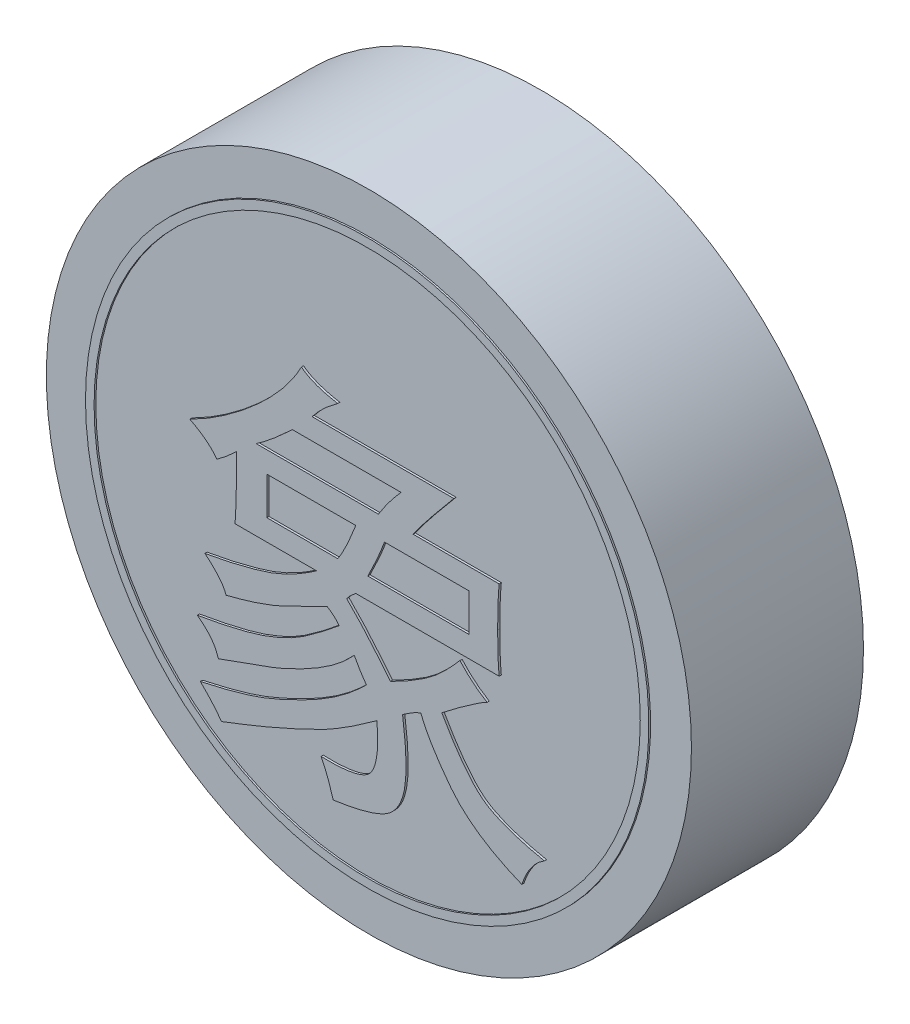
from build123d import *

# Parameters (mm, degrees)
SKETCH_1_R               = 15
DIAMETER30_HEIGHT8_DEPTH = 8
CHARACTER_DEPTH          = 0.1
SKETCH_3_R               = 13.1
SKETCH_3_R_2             = 12.7
INK_RING_DEPTH           = 0.08


with BuildPart() as part:
    # 草图1 → Diameter30_Height8 (new body)
    with BuildSketch(Plane.XY):
        Circle(SKETCH_1_R)
    extrude(amount=-DIAMETER30_HEIGHT8_DEPTH)

    # 草图2 → Character_象 (add)
    with BuildSketch(Plane.XY):
        with BuildLine():
            add(Edge.make_bspline(
                [(-0.929824561, -1.903508772), (-0.828743166, -2.004305693), (-0.635654735, -2.196850711), (-0.367903893, -2.481889137), (-0.12888562, -2.742919032), (0.088565858, -2.993303237), (0.304738016, -3.253167706), (0.548069364, -3.536422638), (0.813868216, -3.86678204), (1.004480711, -4.097376274), (1.105263158, -4.219298246)],
                knots=[0, 0, 0, 0, 1.110570339, 2.121441658, 3.042347323, 3.864152732, 4.701322879, 5.672279288, 6.769265416, 8, 8, 8, 8], degree=3))
            add(Edge.make_bspline(
                [(1.105263158, -4.219298246), (1.263308951, -4.137710103), (1.570224915, -3.979270558), (2.011035586, -3.736783677), (2.412727785, -3.487723983), (2.795695198, -3.24013725), (3.166100989, -2.953776542), (3.544692025, -2.615976785), (3.936594798, -2.212129154), (4.196832054, -1.917630288), (4.333333333, -1.763157895)],
                knots=[0, 0, 0, 0, 1.043545067, 2.026505312, 2.950571977, 3.816170627, 4.700665882, 5.694331323, 6.790616194, 8, 8, 8, 8], degree=3))
            add(Edge.make_bspline(
                [(4.333333333, -1.763157895), (4.42790443, -1.865267048), (4.616739779, -2.069154054), (4.926361469, -2.344080436), (5.249755107, -2.598635688), (5.480734886, -2.74329363), (5.596491228, -2.815789474)],
                knots=[0, 0, 0, 0, 1.011439186, 2.01959667, 3.007513797, 4, 4, 4, 4], degree=3))
            add(Edge.make_bspline(
                [(5.596491228, -2.815789474), (5.544137443, -2.842857439), (5.4268187, -2.903513602), (5.242508625, -3.019881513), (5.024551415, -3.159977335), (4.779416207, -3.333767264), (4.498420972, -3.529289787), (4.188699149, -3.755864532), (3.851873066, -4.015150294), (3.615212847, -4.195165085), (3.49122807, -4.289473684)],
                knots=[0, 0, 0, 0, 0.549629301, 1.231655349, 2.032014221, 2.967000527, 4.034417747, 5.225908916, 6.546671411, 8, 8, 8, 8], degree=3))
            add(Edge.make_bspline(
                [(3.49122807, -4.289473684), (3.588000347, -4.457355531), (3.774212015, -4.780398036), (4.06003518, -5.234255032), (4.334494295, -5.641493282), (4.602394398, -5.999061028), (4.862037369, -6.308651957), (5.11031353, -6.573598651), (5.351477806, -6.788776456), (5.592415125, -6.959432108), (5.842605156, -7.099520305), (6.111453286, -7.228983899), (6.405140072, -7.353950773), (6.725440224, -7.470417875), (7.072652245, -7.5793096), (7.445742268, -7.681866018), (7.844701467, -7.782440517), (8.120830615, -7.839176967), (8.263157895, -7.868421053)],
                knots=[0, 0, 0, 0, 1.486202843, 2.85978918, 4.113129665, 5.252135739, 6.285069278, 7.211058629, 8.034996073, 8.759608627, 9.470935696, 10.231786858, 11.047645233, 11.91800264, 12.844850006, 13.838006363, 14.885627704, 16, 16, 16, 16], degree=3))
            add(Edge.make_bspline(
                [(8.263157895, -7.868421053), (8.206020036, -7.905389145), (8.089977106, -7.980468712), (7.929184397, -8.116179271), (7.780767929, -8.272730064), (7.646055706, -8.449532578), (7.516088949, -8.641819632), (7.404305757, -8.858684382), (7.299214682, -9.09269016), (7.240570791, -9.257612265), (7.210526316, -9.342105263)],
                knots=[0, 0, 0, 0, 0.882392205, 1.792075865, 2.722432891, 3.675867886, 4.673605813, 5.729677539, 6.836866955, 8, 8, 8, 8], degree=3))
            add(Edge.make_bspline(
                [(7.210526316, -9.342105263), (7.028513508, -9.266211584), (6.674438587, -9.118573354), (6.171719859, -8.867864212), (5.703171782, -8.614170137), (5.275236792, -8.341866936), (4.884914504, -8.06055426), (4.534294439, -7.763895988), (4.218668392, -7.459859643), (3.945252749, -7.139348591), (3.705320935, -6.815912929), (3.476257516, -6.504250126), (3.270431153, -6.197689208), (3.077821516, -5.901770903), (2.910470835, -5.609301836), (2.75646074, -5.327986995), (2.622026019, -5.053373888), (2.545999688, -4.870331828), (2.50877193, -4.780701754)],
                knots=[0, 0, 0, 0, 1.402005598, 2.727363134, 3.993048918, 5.189525805, 6.331940506, 7.411907485, 8.453221336, 9.444943128, 10.403636806, 11.316844739, 12.19519781, 13.029237124, 13.827081363, 14.59072091, 15.309919328, 16, 16, 16, 16], degree=3))
            add(Edge.make_bspline(
                [(2.50877193, -4.780701754), (2.44678808, -4.807449537), (2.314995297, -4.864321846), (2.113751629, -4.976839779), (1.894790194, -5.113704486), (1.745067828, -5.217551171), (1.666666667, -5.271929825)],
                knots=[0, 0, 0, 0, 0.828774227, 1.762176171, 2.828177836, 4, 4, 4, 4], degree=3))
            add(Edge.make_bspline(
                [(1.666666667, -5.271929825), (1.6882625, -5.436439302), (1.729920898, -5.753778344), (1.777254782, -6.214838325), (1.807566, -6.643928413), (1.828680049, -7.041698776), (1.826748323, -7.408462587), (1.817192924, -7.743570187), (1.784349637, -8.046146182), (1.742677864, -8.319635781), (1.678971869, -8.566173326), (1.601486451, -8.792064676), (1.505775788, -8.998315058), (1.390228621, -9.184757599), (1.257750812, -9.351567846), (1.107551929, -9.498963433), (0.940669648, -9.627630527), (0.752176213, -9.734440338), (0.543791689, -9.827288689), (0.31396618, -9.915989893), (0.060674025, -9.998581098), (-0.217571459, -10.072731846), (-0.518450691, -10.147275117), (-0.845381499, -10.208925663), (-1.19469197, -10.274185765), (-1.436479122, -10.307400379), (-1.561403509, -10.324561404)],
                knots=[0, 0, 0, 0, 1.649230934, 3.181369092, 4.606057711, 5.92503094, 7.139285108, 8.251032652, 9.255324516, 10.162831072, 10.998302206, 11.782679226, 12.533926344, 13.253250842, 13.957993629, 14.64612434, 15.340264104, 16.046321073, 16.793956285, 17.606385427, 18.494187721, 19.440577461, 20.468228072, 21.574458556, 22.746793299, 24, 24, 24, 24], degree=3))
            add(Edge.make_bspline(
                [(-1.561403509, -10.324561404), (-1.598378631, -10.196852294), (-1.671857895, -9.943060799), (-1.802157951, -9.569418455), (-1.953258682, -9.205797776), (-2.066331616, -8.969098834), (-2.122807018, -8.850877193)],
                knots=[0, 0, 0, 0, 1.010024267, 2.007183108, 3.004667778, 4, 4, 4, 4], degree=3))
            add(Edge.make_bspline(
                [(-2.122807018, -8.850877193), (-1.966869659, -8.855238357), (-1.67224315, -8.863478298), (-1.253809565, -8.848384695), (-0.88538314, -8.811002274), (-0.565123639, -8.752196228), (-0.293372988, -8.674565414), (-0.06956973, -8.573160897), (0.10888208, -8.450043127), (0.233070526, -8.292060231), (0.321108577, -8.113205604), (0.39495621, -7.911275203), (0.446817096, -7.679562792), (0.485565396, -7.420739837), (0.508828255, -7.134195927), (0.512186341, -6.819186367), (0.5020602, -6.475770691), (0.483397854, -6.237864099), (0.473684211, -6.114035088)],
                knots=[0, 0, 0, 0, 1.58471914, 2.994152737, 4.251101141, 5.343957484, 6.29925099, 7.114494205, 7.832878125, 8.477647425, 9.131190312, 9.852427002, 10.657387502, 11.53880839, 12.510349002, 13.575629989, 14.738129365, 16, 16, 16, 16], degree=3))
            add(Edge.make_bspline(
                [(0.473684211, -6.114035088), (0.347187426, -6.204122011), (0.100672391, -6.379682056), (-0.259624694, -6.636613384), (-0.608445705, -6.869485719), (-0.941052133, -7.085381948), (-1.257126872, -7.283913504), (-1.560315475, -7.459639019), (-1.84439206, -7.62254617), (-2.378821322, -7.896324739), (-3.170280863, -8.27191044), (-4.056917556, -8.677340052), (-4.796894435, -8.988172781), (-5.40245326, -9.236084417), (-6.059649245, -9.497940279), (-6.517639841, -9.672779424), (-6.754385965, -9.763157895)],
                knots=[0, 0, 0, 0, 0.802634635, 1.564162327, 2.28693694, 2.970022653, 3.613619897, 4.215691619, 4.781081017, 5.305786877, 7.318484086, 9.308460638, 10.343841297, 11.466371935, 12.690307994, 14, 14, 14, 14], degree=3))
            add(Edge.make_bspline(
                [(-6.754385965, -9.763157895), (-6.808823097, -9.686144779), (-6.928980908, -9.516155528), (-7.151382439, -9.254577297), (-7.423646659, -8.95644167), (-7.627730051, -8.750471622), (-7.736842105, -8.640350877)],
                knots=[0, 0, 0, 0, 0.757198483, 1.671346525, 2.754998321, 4, 4, 4, 4], degree=3))
            add(Edge.make_bspline(
                [(-7.736842105, -8.640350877), (-7.519124707, -8.592957982), (-7.09382113, -8.500377564), (-6.473677177, -8.34554628), (-5.883610448, -8.186126947), (-5.408946683, -8.040118666), (-5.032118, -7.914743296), (-4.738483602, -7.804962586), (-4.430340787, -7.68013717), (-4.108065065, -7.542200968), (-3.771569852, -7.391178338), (-3.421953424, -7.224724354), (-3.056977538, -7.044894705), (-2.555348804, -6.788438549), (-1.939573575, -6.441599315), (-1.24350185, -5.978426785), (-0.600493767, -5.474729191), (-0.21057341, -5.104389031), (-0.01754386, -4.921052632)],
                knots=[0, 0, 0, 0, 1.231346762, 2.405394272, 3.532091312, 4.608932932, 5.149473193, 5.726685741, 6.341068464, 6.986744666, 7.66396097, 8.379304989, 9.126623402, 9.91251923, 11.49284938, 13.029304255, 14.529361054, 16, 16, 16, 16], degree=3))
            add(Edge.make_bspline(
                [(-0.01754386, -4.921052632), (-0.073600096, -4.840887334), (-0.182134735, -4.685673353), (-0.330334372, -4.452797679), (-0.464455543, -4.230409008), (-0.541584644, -4.081099932), (-0.578947368, -4.00877193)],
                knots=[0, 0, 0, 0, 1.09470491, 2.1195394, 3.089071053, 4, 4, 4, 4], degree=3))
            add(Edge.make_bspline(
                [(-0.578947368, -4.00877193), (-0.714328109, -4.14816026), (-0.989907684, -4.431897642), (-1.458561813, -4.820004052), (-1.97905234, -5.184676554), (-2.539706302, -5.524155532), (-3.117016894, -5.82784172), (-3.679463968, -6.105854271), (-4.222687922, -6.34066729), (-4.927567318, -6.599523085), (-5.819165164, -6.906907671), (-6.529671823, -7.171214304), (-6.894736842, -7.307017544)],
                knots=[0, 0, 0, 0, 0.809267059, 1.647335296, 2.530801539, 3.455846417, 4.376477467, 5.248389781, 6.069933452, 6.841097681, 8.376926212, 10, 10, 10, 10], degree=3))
            add(Edge.make_bspline(
                [(-6.894736842, -7.307017544), (-6.937076913, -7.190505473), (-7.023636666, -6.952308989), (-7.243969076, -6.62521988), (-7.527262626, -6.314260434), (-7.757158667, -6.136613457), (-7.877192982, -6.043859649)],
                knots=[0, 0, 0, 0, 0.910856203, 1.862148215, 2.88377558, 4, 4, 4, 4], degree=3))
            add(Edge.make_bspline(
                [(-7.877192982, -6.043859649), (-7.712536052, -6.01467887), (-7.392450383, -5.957952748), (-6.927597399, -5.87088588), (-6.493072331, -5.778650696), (-6.087814341, -5.689427197), (-5.713001525, -5.594970728), (-5.367237322, -5.501532774), (-5.050094763, -5.409616914), (-4.672705808, -5.281802065), (-4.238196769, -5.113551788), (-3.750865455, -4.896920945), (-3.304167742, -4.660254), (-2.89242272, -4.400235119), (-2.498719456, -4.117281629), (-2.098405863, -3.822095327), (-1.6894032, -3.505028667), (-1.418705944, -3.280919685), (-1.280701754, -3.166666667)],
                knots=[0, 0, 0, 0, 1.096863902, 2.132254105, 3.101883048, 4.010422, 4.853915215, 5.636911916, 6.359754767, 7.019266169, 8.249777128, 9.414730366, 10.515502993, 11.562415892, 12.606177758, 13.695004187, 14.824889902, 16, 16, 16, 16], degree=3))
            add(Edge.make_bspline(
                [(-1.280701754, -3.166666667), (-1.317986132, -3.120872439), (-1.393589166, -3.028013641), (-1.525542811, -2.899471003), (-1.675536629, -2.780417155), (-1.785965472, -2.710820254), (-1.842105263, -2.675438596)],
                knots=[0, 0, 0, 0, 0.943775431, 1.913731418, 2.939383241, 4, 4, 4, 4], degree=3))
            add(Edge.make_bspline(
                [(-1.842105263, -2.675438596), (-2.172052985, -2.839460266), (-2.837519636, -3.170273132), (-3.59200137, -3.540548178), (-4.113060006, -3.784596457), (-4.398911163, -3.902662952), (-4.704347865, -4.021049645), (-5.032059134, -4.133475981), (-5.379320415, -4.249580933), (-5.749668894, -4.356574177), (-6.138951141, -4.467129505), (-6.406801125, -4.535295155), (-6.543859649, -4.570175439)],
                knots=[0, 0, 0, 0, 2.174054055, 4.384817278, 4.958909761, 5.568392443, 6.209182902, 6.891410063, 7.612371255, 8.369329936, 9.165588032, 10, 10, 10, 10], degree=3))
            add(Edge.make_bspline(
                [(-6.543859649, -4.570175439), (-6.558399765, -4.527287082), (-6.588884819, -4.437366626), (-6.658814164, -4.304781058), (-6.748294372, -4.165633707), (-6.861215707, -4.020264054), (-6.996086984, -3.867810535), (-7.153538896, -3.709576582), (-7.329621341, -3.542121616), (-7.458972676, -3.433660299), (-7.526315789, -3.377192982)],
                knots=[0, 0, 0, 0, 0.693681639, 1.454384706, 2.291140141, 3.229370599, 4.274444009, 5.41144842, 6.65234386, 8, 8, 8, 8], degree=3))
            add(Edge.make_bspline(
                [(-7.526315789, -3.377192982), (-7.266181713, -3.329012843), (-6.761095832, -3.235464515), (-6.03180552, -3.079968737), (-5.356809135, -2.902795901), (-4.721294272, -2.720358049), (-4.110945647, -2.498010628), (-3.515248063, -2.211794386), (-2.914970623, -1.879289851), (-2.529741552, -1.616459588), (-2.333333333, -1.48245614)],
                knots=[0, 0, 0, 0, 1.137772307, 2.209140512, 3.205919273, 4.138448836, 5.052058767, 5.995422594, 6.977970497, 8, 8, 8, 8], degree=3))
            Line((-2.333333333, -1.48245614), (-6.122807018, -1.48245614))
            add(Edge.make_bspline(
                [(-6.122807018, -1.48245614), (-6.117601194, -1.390623471), (-6.106650964, -1.197457336), (-6.089678174, -0.895212635), (-6.081359739, -0.565834633), (-6.069816218, -0.210685101), (-6.062260237, 0.171408515), (-6.058144424, 0.579490388), (-6.051119302, 1.013517411), (-6.052117823, 1.311562846), (-6.052631579, 1.464912281)],
                knots=[0, 0, 0, 0, 0.748661925, 1.574778685, 2.463722955, 3.43019847, 4.466993754, 5.574178629, 6.751873734, 8, 8, 8, 8], degree=3))
            add(Edge.make_bspline(
                [(-6.052631579, 1.464912281), (-6.196500302, 1.327617019), (-6.485194855, 1.052113118), (-6.804653439, 0.812956968), (-6.964912281, 0.692982456)],
                knots=[0, 0, 0, 0, 0.996684702, 2, 2, 2, 2], degree=3))
            add(Edge.make_bspline(
                [(-6.964912281, 0.692982456), (-7.041285503, 0.786286313), (-7.199047549, 0.979021501), (-7.494133322, 1.232817643), (-7.838433335, 1.470604086), (-8.094778716, 1.605366447), (-8.228070175, 1.675438596)],
                knots=[0, 0, 0, 0, 0.894966504, 1.848707456, 2.881396178, 4, 4, 4, 4], degree=3))
            add(Edge.make_bspline(
                [(-8.228070175, 1.675438596), (-7.970288316, 1.811101669), (-7.446538837, 2.086735742), (-6.689930721, 2.578940325), (-5.935992941, 3.126722959), (-5.32776663, 3.634701005), (-4.856057561, 4.063495675), (-4.523540312, 4.389986854), (-4.216717349, 4.719375239), (-3.929239673, 5.045344412), (-3.669456935, 5.37545267), (-3.435054904, 5.707765533), (-3.22022989, 6.038154703), (-3.096088363, 6.265486648), (-3.035087719, 6.377192982)],
                knots=[0, 0, 0, 0, 1.47592763, 2.998722752, 4.570191903, 6.198038662, 7.012500948, 7.801291712, 8.559411387, 9.293963217, 10.00385317, 10.687445814, 11.355037339, 12, 12, 12, 12], degree=3))
            add(Edge.make_bspline(
                [(-3.035087719, 6.377192982), (-2.991563612, 6.342490813), (-2.900252438, 6.269687578), (-2.743094117, 6.174267986), (-2.562916618, 6.087278077), (-2.362843209, 6.003707193), (-2.141262704, 5.928811354), (-1.897982984, 5.8618445), (-1.632700399, 5.799267987), (-1.447194051, 5.763950992), (-1.350877193, 5.745614035)],
                knots=[0, 0, 0, 0, 0.734457435, 1.540851154, 2.420812151, 3.374703154, 4.402108324, 5.506789767, 6.705498883, 8, 8, 8, 8], degree=3))
            add(Edge.make_bspline(
                [(-1.350877193, 5.745614035), (-1.464675277, 5.66222105), (-1.689471919, 5.497486617), (-2.003144847, 5.226418298), (-2.287165974, 4.934153545), (-2.458591155, 4.726230094), (-2.543859649, 4.622807018)],
                knots=[0, 0, 0, 0, 1.029479124, 2.033632219, 3.0219102, 4, 4, 4, 4], degree=3))
            Line((-2.543859649, 4.622807018), (4.052631579, 4.622807018))
            add(Edge.make_bspline(
                [(4.052631579, 4.622807018), (3.935712871, 4.482423282), (3.712097761, 4.213929685), (3.391297808, 3.830024312), (3.105550795, 3.478292749), (2.851177725, 3.162478258), (2.630212862, 2.881782307), (2.441907458, 2.637440654), (2.287805879, 2.426710097), (2.198336721, 2.295948955), (2.157894737, 2.236842105)],
                knots=[0, 0, 0, 0, 1.438623262, 2.751466418, 3.939472877, 5.007039666, 5.944651069, 6.752429781, 7.436071417, 8, 8, 8, 8], degree=3))
            Line((2.157894737, 2.236842105), (6.157894737, 2.236842105))
            add(Edge.make_bspline(
                [(6.157894737, 2.236842105), (6.146543755, 2.109551335), (6.122094831, 1.835379231), (6.104113144, 1.392269721), (6.090689128, 0.887999847), (6.088746862, 0.530985253), (6.087719298, 0.342105263)],
                knots=[0, 0, 0, 0, 0.808434884, 1.741291153, 2.805021106, 4, 4, 4, 4], degree=3))
            add(Edge.make_bspline(
                [(6.087719298, 0.342105263), (6.088720132, 0.15495633), (6.090596965, -0.195998191), (6.104038444, -0.687266239), (6.121494301, -1.108798242), (6.146508014, -1.365569105), (6.157894737, -1.48245614)],
                knots=[0, 0, 0, 0, 1.229412054, 2.305477845, 3.22862092, 4, 4, 4, 4], degree=3))
            Line((6.157894737, -1.48245614), (-0.50877193, -1.48245614))
            add(Edge.make_bspline(
                [(-0.50877193, -1.48245614), (-0.593534936, -1.549349281), (-0.750542692, -1.673256425), (-0.873327147, -1.83094894), (-0.929824561, -1.903508772)],
                knots=[0, 0, 0, 0, 1.07973018, 2, 2, 2, 2], degree=3))
        make_face()
        with BuildLine():
            Line((4.754385965, -0.5), (4.754385965, 1.254385965))
            Line((4.754385965, 1.254385965), (0.824561404, 1.254385965))
            add(Edge.make_bspline(
                [(0.824561404, 1.254385965), (0.774405822, 1.120586442), (0.670418432, 0.843180366), (0.488876169, 0.418033966), (0.280855152, -0.032659721), (0.130338921, -0.340876338), (0.052631579, -0.5)],
                knots=[0, 0, 0, 0, 0.894064617, 1.853661004, 2.891904906, 4, 4, 4, 4], degree=3))
            Line((0.052631579, -0.5), (4.754385965, -0.5))
        make_face(mode=Mode.SUBTRACT)
        with BuildLine():
            add(Edge.make_bspline(
                [(0.543859649, 2.236842105), (0.617150512, 2.354600399), (0.766290706, 2.594227746), (1.017408237, 2.945406394), (1.295469119, 3.295569029), (1.495062077, 3.524176918), (1.596491228, 3.640350877)],
                knots=[0, 0, 0, 0, 0.947173216, 1.927410771, 2.946751592, 4, 4, 4, 4], degree=3))
            Line((1.596491228, 3.640350877), (-3.456140351, 3.640350877))
            add(Edge.make_bspline(
                [(-3.456140351, 3.640350877), (-3.5418, 3.561392945), (-3.707290734, 3.408849637), (-3.949966343, 3.188754836), (-4.180392152, 2.987822598), (-4.396117804, 2.801159723), (-4.601115829, 2.63642379), (-4.791908057, 2.486474798), (-4.969613405, 2.354752635), (-5.085567192, 2.274675472), (-5.140350877, 2.236842105)],
                knots=[0, 0, 0, 0, 1.27415176, 2.461606039, 3.582951637, 4.617898728, 5.581273312, 6.458861859, 7.271871757, 8, 8, 8, 8], degree=3))
            Line((-5.140350877, 2.236842105), (0.543859649, 2.236842105))
        make_face(mode=Mode.SUBTRACT)
        with BuildLine():
            add(Edge.make_bspline(
                [(-1.350877193, -0.5), (-1.319983381, -0.455316869), (-1.254179354, -0.3601415), (-1.161146297, -0.199535288), (-1.06396273, -0.015828556), (-0.958318152, 0.190083307), (-0.852763183, 0.42242167), (-0.742325976, 0.678585471), (-0.623525939, 0.957358099), (-0.548026651, 1.152779528), (-0.50877193, 1.254385965)],
                knots=[0, 0, 0, 0, 0.668327248, 1.423541546, 2.282165783, 3.226300311, 4.271090304, 5.421920148, 6.659566098, 8, 8, 8, 8], degree=3))
            Line((-0.50877193, 1.254385965), (-4.649122807, 1.254385965))
            Line((-4.649122807, 1.254385965), (-4.649122807, -0.5))
            Line((-4.649122807, -0.5), (-1.350877193, -0.5))
        make_face(mode=Mode.SUBTRACT)
    extrude(amount=CHARACTER_DEPTH)

    # 草图3 → Ink_ring (add)
    with BuildSketch(Plane.XY):
        with Locations(Location((0, 0, 0), (0, 0, 180))):
            Circle(SKETCH_3_R)
        with Locations(Location((0, 0, 0), (0, 0, 180))):
            Circle(SKETCH_3_R_2, mode=Mode.SUBTRACT)
    extrude(amount=INK_RING_DEPTH)


solid = part.part
